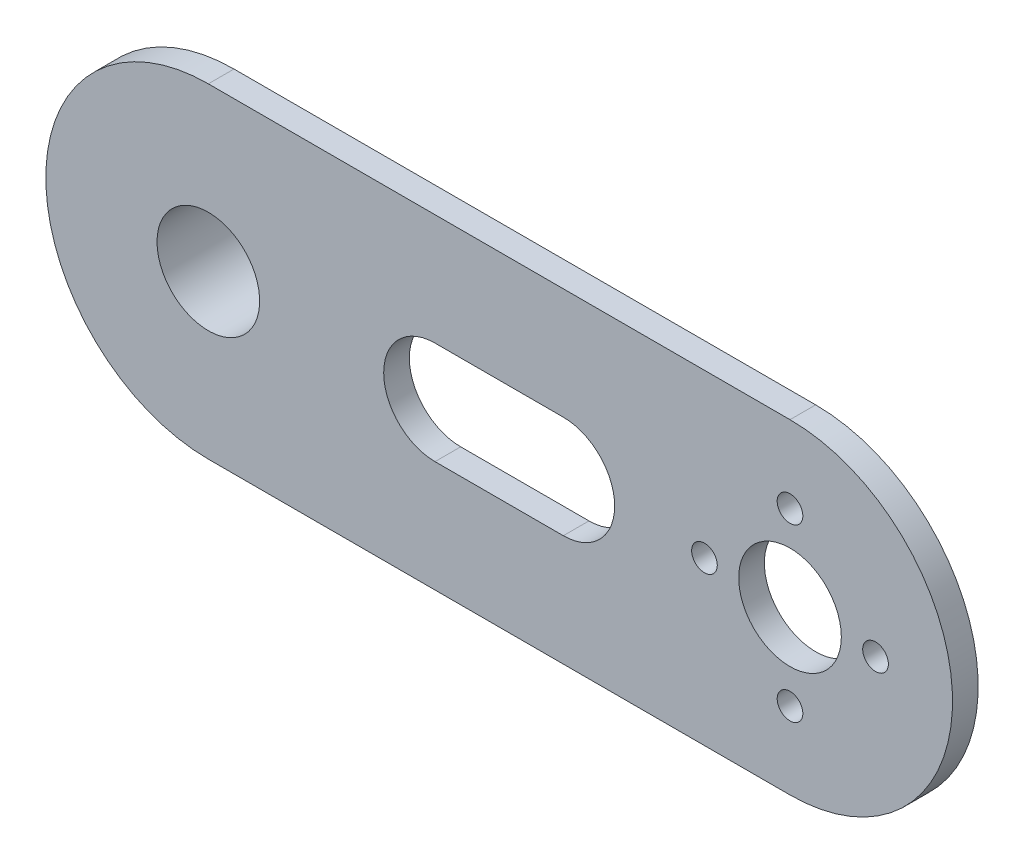
from build123d import *

# Parameters (mm, degrees)
SKETCH_1_R          = 9.985
EXTRUDE_1_DEPTH     = 4
SKETCH_2_R          = 11.5
EXTRUDE_2_DEPTH     = 2
SKETCH_3_R          = 19
EXTRUDE_3_DEPTH     = 3
SKETCH_4_R          = 6
CUT_EXTRUDE_1_DEPTH = 29.337254631
EXTRUDE_START       = -3
SKETCH_5_R          = 1.5
SKETCH_5_R_2        = 6
EXTRUDE_4_DEPTH     = 3
SKETCH_6_R          = 6
CUT_EXTRUDE_2_DEPTH = 90.504189846


with BuildPart() as part:
    # 草图1 → 凸台-拉伸1 (new body)
    with BuildSketch(Plane.XY):
        Circle(SKETCH_1_R)
    extrude(amount=EXTRUDE_1_DEPTH)

    # 草图2 → 凸台-拉伸2 (add)
    with BuildSketch(Plane.XY.offset(4)):
        Circle(SKETCH_2_R)
    extrude(amount=EXTRUDE_2_DEPTH)

    # 草图3 → 凸台-拉伸3 (add)
    with BuildSketch(Plane.XY.offset(6)):
        Circle(SKETCH_3_R)
    extrude(amount=EXTRUDE_3_DEPTH)

    # 草图4 → 切除-拉伸1 (cut, through all)
    with BuildSketch(Plane(origin=(0, 0, 0), x_dir=(-1, 0, 0), z_dir=(0, 0, -1))):
        Circle(SKETCH_4_R)
    extrude(amount=-CUT_EXTRUDE_1_DEPTH, mode=Mode.SUBTRACT)

    # 草图5 → 凸台-拉伸4 (add)
    # profile 1 of 2: a face of its own
    with BuildSketch(Plane.XY.offset(9).offset(EXTRUDE_START)):
        with BuildLine():
            Line((68, 19), (0, 19))
            ThreePointArc((0, 19), (13.435028843, 13.435028843), (19, 0))
            ThreePointArc((19, 0), (13.435028843, -13.435028843), (0, -19))
            Line((0, -19), (68, -19))
            ThreePointArc((68, -19), (49, 0), (68, 19))
        make_face()
    # profile 2 of 2: a face of its own
    with BuildSketch(Plane.XY.offset(9).offset(EXTRUDE_START)):
        with BuildLine():
            ThreePointArc((87, 0), (81.435028843, 13.435028843), (68, 19))
            ThreePointArc((68, 19), (49, 0), (68, -19))
            ThreePointArc((68, -19), (81.435028843, -13.435028843), (87, 0))
        make_face()
        with Locations((68, -10)):
            Circle(SKETCH_5_R, mode=Mode.SUBTRACT)
        with Locations((58, 0)):
            Circle(SKETCH_5_R, mode=Mode.SUBTRACT)
        with Locations((68, 0)):
            Circle(SKETCH_5_R_2, mode=Mode.SUBTRACT)
        with Locations((78, 0)):
            Circle(SKETCH_5_R, mode=Mode.SUBTRACT)
        with Locations((68, 10)):
            Circle(SKETCH_5_R, mode=Mode.SUBTRACT)
    extrude(amount=EXTRUDE_4_DEPTH)

    # 草图6 → 切除-拉伸2 (cut, through all)
    with BuildSketch(Plane.XY.offset(9)):
        with Locations((68, 0)):
            Circle(SKETCH_6_R)
        with BuildLine():
            Line((26.5, 6), (41.5, 6))
            ThreePointArc((41.5, 6), (47.5, 0), (41.5, -6))
            Line((41.5, -6), (26.5, -6))
            ThreePointArc((26.5, -6), (20.5, 0), (26.5, 6))
        make_face()
    extrude(amount=-CUT_EXTRUDE_2_DEPTH, mode=Mode.SUBTRACT)


solid = part.part
